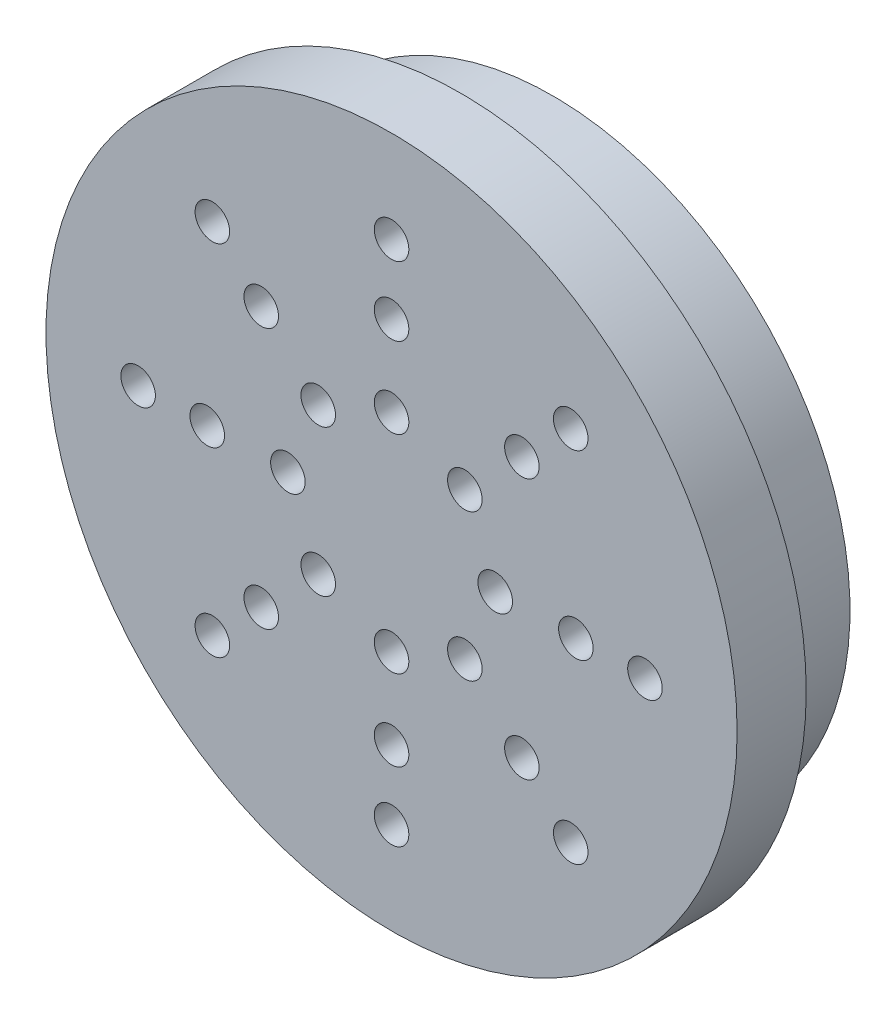
from build123d import *

# Parameters (mm, degrees)
SKETCH2_R           = 15
BOSS_EXTRUDE1_DEPTH = 3
SKETCH3_R           = 12.9
BOSS_EXTRUDE2_DEPTH = 4
SKETCH4_R           = 0.75
CUT_EXTRUDE1_DEPTH  = 23.338307904


with BuildPart() as part:
    # Sketch2 → Boss-Extrude1 (new body)
    with BuildSketch(Plane.XY):
        Circle(SKETCH2_R)
    extrude(amount=BOSS_EXTRUDE1_DEPTH)

    # Sketch3 → Boss-Extrude2 (add)
    with BuildSketch(Plane(origin=(0, 0, 0), x_dir=(-1, 0, 0), z_dir=(0, 0, -1))):
        Circle(SKETCH3_R)
    extrude(amount=BOSS_EXTRUDE2_DEPTH)

    # Sketch4 → Cut-Extrude1 (cut, through all)
    with BuildSketch(Plane.XY.offset(3)):
        with Locations((-4.5, 0)):
            Circle(SKETCH4_R)
        with Locations((-8, 0)):
            Circle(SKETCH4_R)
        with Locations((-11, 0)):
            Circle(SKETCH4_R)
        with Locations((-3.181980515, 3.181980515)):
            Circle(SKETCH4_R)
        with Locations((-5.656854249, 5.656854249)):
            Circle(SKETCH4_R)
        with Locations((-7.778174593, 7.778174593)):
            Circle(SKETCH4_R)
        with Locations((0, 4.5)):
            Circle(SKETCH4_R)
        with Locations((0, 8)):
            Circle(SKETCH4_R)
        with Locations((0, 11)):
            Circle(SKETCH4_R)
        with Locations((3.181980515, 3.181980515)):
            Circle(SKETCH4_R)
        with Locations((5.656854249, 5.656854249)):
            Circle(SKETCH4_R)
        with Locations((7.778174593, 7.778174593)):
            Circle(SKETCH4_R)
        with Locations((4.5, 0)):
            Circle(SKETCH4_R)
        with Locations((8, 0)):
            Circle(SKETCH4_R)
        with Locations((11, 0)):
            Circle(SKETCH4_R)
        with Locations((3.181980515, -3.181980515)):
            Circle(SKETCH4_R)
        with Locations((5.656854249, -5.656854249)):
            Circle(SKETCH4_R)
        with Locations((7.778174593, -7.778174593)):
            Circle(SKETCH4_R)
        with Locations((0, -4.5)):
            Circle(SKETCH4_R)
        with Locations((0, -8)):
            Circle(SKETCH4_R)
        with Locations((0, -11)):
            Circle(SKETCH4_R)
        with Locations((-3.181980515, -3.181980515)):
            Circle(SKETCH4_R)
        with Locations((-5.656854249, -5.656854249)):
            Circle(SKETCH4_R)
        with Locations((-7.778174593, -7.778174593)):
            Circle(SKETCH4_R)
    extrude(amount=-CUT_EXTRUDE1_DEPTH, mode=Mode.SUBTRACT)


solid = part.part
